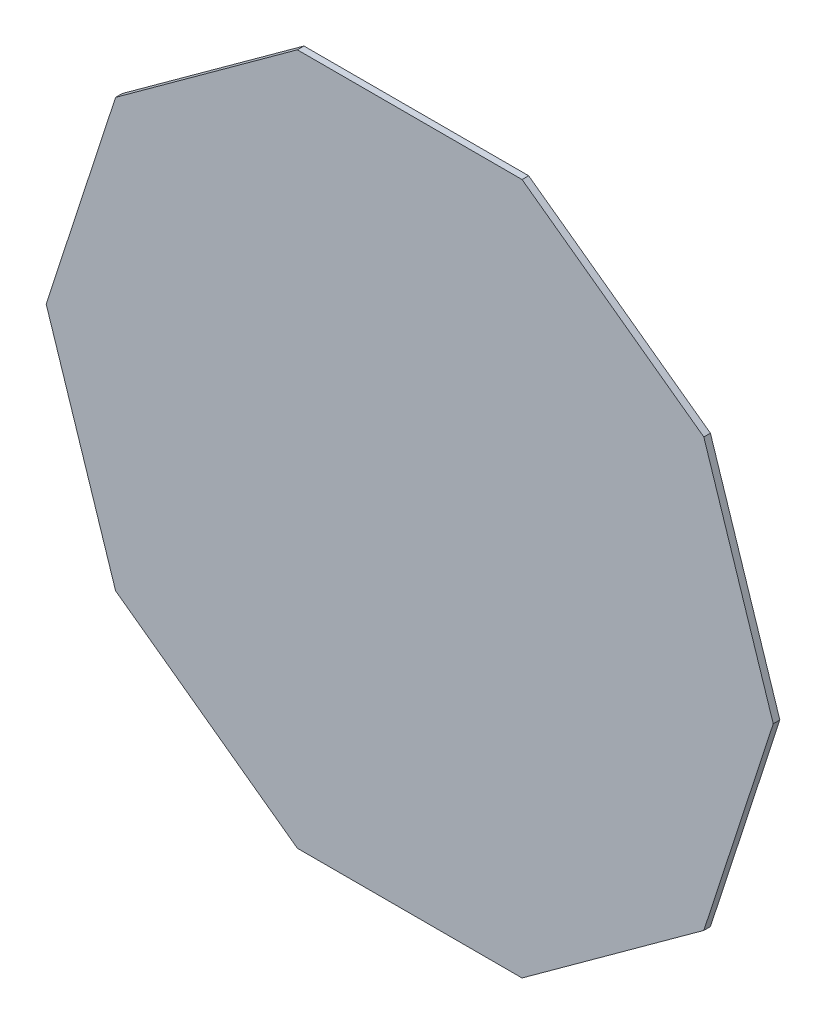
from build123d import *

# Parameters (mm, degrees)
BOSS_EXTRUDE1_DEPTH = 114.3


with BuildPart() as part:
    # Sketch1 → Boss-Extrude1 (new body)
    with BuildSketch(Plane.XY):
        Polygon((6308.77334543, 0), (5103.904850112, 3708.203932499), (1949.518177397, 6000), (-1949.518177397, 6000), (-5103.904850112, 3708.203932499), (-6308.77334543, 0), (-5103.904850112, -3708.203932499), (-1949.518177397, -6000), (1949.518177397, -6000), (5103.904850112, -3708.203932499), align=None)
    extrude(amount=BOSS_EXTRUDE1_DEPTH)


solid = part.part
